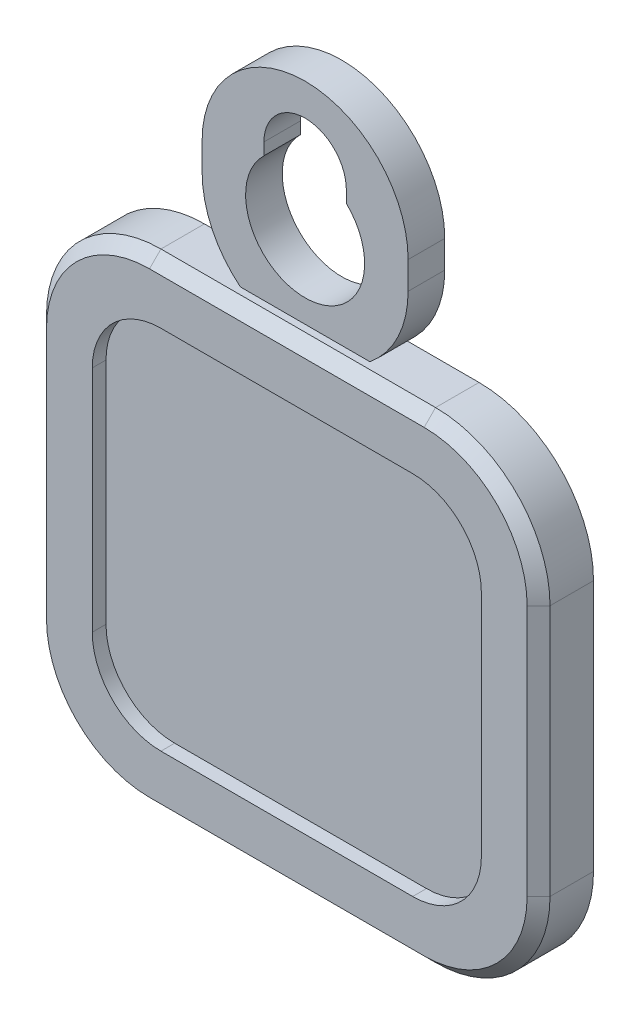
from build123d import *

# Parameters (mm, degrees)
BOSS_EXTRUDE1_START = 80.3
BOSS_EXTRUDE1_DEPTH = 2.4
BOSS_EXTRUDE2_START = 80.3
BOSS_EXTRUDE2_DEPTH = 1.6
BOSS_EXTRUDE3_START = 79.3
BOSS_EXTRUDE3_DEPTH = 4.4
BOSS_EXTRUDE4_START = 79.3
SKETCH4_R           = 2.6
BOSS_EXTRUDE4_DEPTH = 4.4
BOSS_EXTRUDE5_START = 82.1
BOSS_EXTRUDE5_DEPTH = 1.6
CHAMFER1_SIZE       = 0.5


with BuildPart() as part:
    # Sketch1 → Boss-Extrude1 (new body)
    with BuildSketch(Plane.XY.offset(BOSS_EXTRUDE1_START)):
        with BuildLine():
            Line((-6, 29), (6, 29))
            ThreePointArc((6, 29), (9.535533906, 30.464466094), (11, 34))
            Line((11, 34), (11, 45))
            ThreePointArc((11, 45), (9.535533906, 48.535533906), (6, 50))
            Line((6, 50), (-6, 50))
            ThreePointArc((-6, 50), (-9.535533906, 48.535533906), (-11, 45))
            Line((-11, 45), (-11, 34))
            ThreePointArc((-11, 34), (-9.535533906, 30.464466094), (-6, 29))
        make_face()
    extrude(amount=BOSS_EXTRUDE1_DEPTH)

    # Sketch2 → Boss-Extrude2 (add)
    with BuildSketch(Plane.XY.offset(BOSS_EXTRUDE2_START)):
        with BuildLine():
            Line((4.5, 53.5), (4.5, 54.7))
            ThreePointArc((4.5, 54.7), (3.181980515, 57.881980515), (0, 59.2))
            ThreePointArc((0, 59.2), (-3.181980515, 57.881980515), (-4.5, 54.7))
            Line((-4.5, 54.7), (-4.5, 53.5))
            ThreePointArc((-4.5, 53.5), (-3.181980515, 50.318019485), (0, 49))
            ThreePointArc((0, 49), (3.181980515, 50.318019485), (4.5, 53.5))
        make_face()
    extrude(amount=BOSS_EXTRUDE2_DEPTH)


with BuildPart() as body_2:
    # Sketch3 → Boss-Extrude3 (new body)
    with BuildSketch(Plane.XY.offset(BOSS_EXTRUDE3_START)):
        with BuildLine():
            Line((-1.8, 56), (-1.8, 53.6))
            ThreePointArc((-1.8, 53.6), (0, 51.8), (1.8, 53.6))
            Line((1.8, 53.6), (1.8, 56))
            ThreePointArc((1.8, 56), (0, 57.8), (-1.8, 56))
        make_face()
    extrude(amount=BOSS_EXTRUDE3_DEPTH)


with BuildPart() as part_1:
    add(part.part)

    # Combine1: cut body 2
    add(body_2.part, mode=Mode.SUBTRACT)


with BuildPart() as body_2_2:
    # Sketch4 → Boss-Extrude4 (new body)
    with BuildSketch(Plane.XY.offset(BOSS_EXTRUDE4_START)):
        with Locations((0, 53.6)):
            Circle(SKETCH4_R)
    extrude(amount=BOSS_EXTRUDE4_DEPTH)


with BuildPart() as part_2:
    add(part_1.part)

    # Combine2: cut body 2 2
    add(body_2_2.part, mode=Mode.SUBTRACT)


with BuildPart() as body_2_3:
    # Sketch5 → Boss-Extrude5 (new body)
    with BuildSketch(Plane.XY.offset(BOSS_EXTRUDE5_START)):
        with BuildLine():
            Line((-5.5, 31.5), (5.5, 31.5))
            ThreePointArc((5.5, 31.5), (7.621320344, 32.378679656), (8.5, 34.5))
            Line((8.5, 34.5), (8.5, 44.5))
            ThreePointArc((8.5, 44.5), (7.621320344, 46.621320344), (5.5, 47.5))
            Line((5.5, 47.5), (-5.5, 47.5))
            ThreePointArc((-5.5, 47.5), (-7.621320344, 46.621320344), (-8.5, 44.5))
            Line((-8.5, 44.5), (-8.5, 34.5))
            ThreePointArc((-8.5, 34.5), (-7.621320344, 32.378679656), (-5.5, 31.5))
        make_face()
    extrude(amount=BOSS_EXTRUDE5_DEPTH)


with BuildPart() as part_3:
    add(part_2.part)

    # Combine3: cut body 2 3
    add(body_2_3.part, mode=Mode.SUBTRACT)

    # Chamfer1
    chamfer1_edges = [part_3.edges().sort_by_distance(p)[0] for p in [
        (0, 50, 82.7),
        (-9.535533906, 48.535533906, 82.7),
        (9.535533906, 48.535533906, 82.7),
        (-11, 39.5, 82.7),
        (11, 39.5, 82.7),
        (-9.535533906, 30.464466094, 82.7),
        (9.535533906, 30.464466094, 82.7),
        (0, 29, 82.7),
    ]]
    chamfer(chamfer1_edges, length=CHAMFER1_SIZE)


solid = part_3.part
